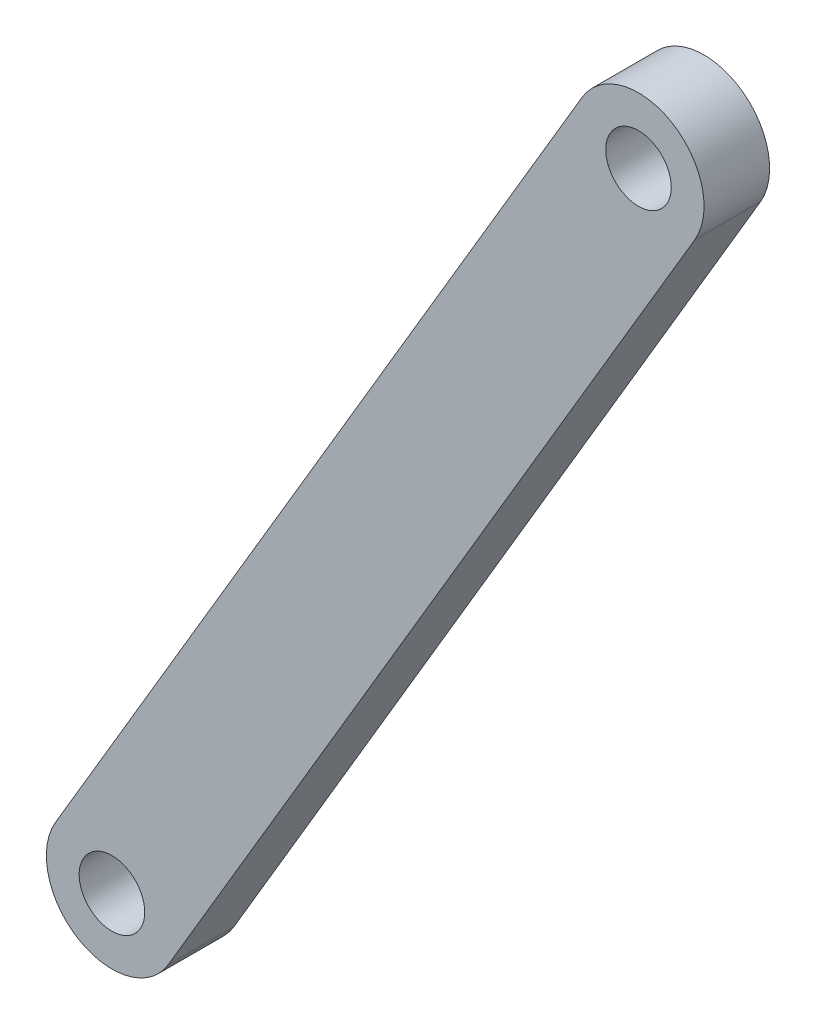
from build123d import *

# Parameters (mm, degrees)
SKETCH1_R           = 3.175
BOSS_EXTRUDE1_DEPTH = 6.35


with BuildPart() as part:
    # Sketch1 → Boss-Extrude1 (new body)
    with BuildSketch(Plane.XY):
        with BuildLine():
            Line((95.931944128, -83.079245267), (146.933116546, 3.230431132))
            ThreePointArc((146.933116546, 3.230431132), (155.630431132, 5.466883454), (157.866883454, -3.230431132))
            Line((157.866883454, -3.230431132), (106.865711037, -89.540107531))
            ThreePointArc((106.865711037, -89.540107531), (98.16839645, -91.776559853), (95.931944128, -83.079245267))
        make_face()
        with Locations((152.4, 0)):
            Circle(SKETCH1_R, mode=Mode.SUBTRACT)
        with Locations((101.398827582, -86.309676399)):
            Circle(SKETCH1_R, mode=Mode.SUBTRACT)
    extrude(amount=BOSS_EXTRUDE1_DEPTH)


solid = part.part
